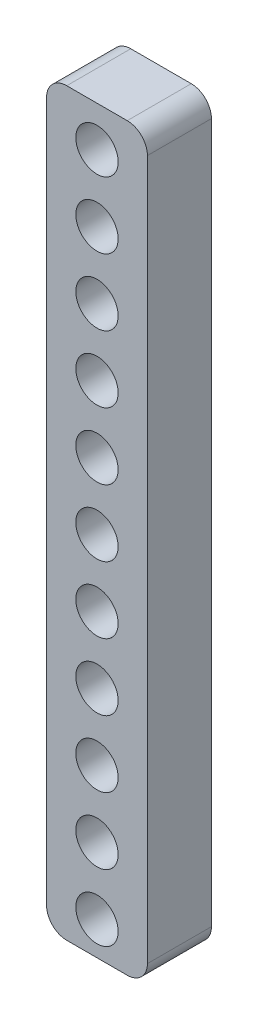
from build123d import *

# Parameters (mm, degrees)
SKETCH1_R           = 2.1
BOSS_EXTRUDE1_DEPTH = 6.35
SKETCH2_W           = 18.204542204
SKETCH2_H           = 91.842735445
CUT_EXTRUDE1_DEPTH  = 81.407229153
FILLET2_R           = 2


with BuildPart() as part:
    # Sketch1 → Boss-Extrude1 (new body)
    with BuildSketch(Plane.XY):
        with BuildLine():
            Line((3, -80), (-3, -80))
            ThreePointArc((-3, -80), (-4.414213562, -79.414213562), (-5, -78))
            Line((-5, -78), (-5, 78))
            ThreePointArc((-5, 78), (-4.414213562, 79.414213562), (-3, 80))
            Line((-3, 80), (3, 80))
            ThreePointArc((3, 80), (4.414213562, 79.414213562), (5, 78))
            Line((5, 78), (5, -78))
            ThreePointArc((5, -78), (4.414213562, -79.414213562), (3, -80))
        make_face()
        with Locations((0, 76)):
            Circle(SKETCH1_R, mode=Mode.SUBTRACT)
        with Locations((0, 69.391304348)):
            Circle(SKETCH1_R, mode=Mode.SUBTRACT)
        with Locations((0, 62.782608696)):
            Circle(SKETCH1_R, mode=Mode.SUBTRACT)
        with Locations((0, 56.173913043)):
            Circle(SKETCH1_R, mode=Mode.SUBTRACT)
        with Locations((0, 49.565217391)):
            Circle(SKETCH1_R, mode=Mode.SUBTRACT)
        with Locations((0, 42.956521739)):
            Circle(SKETCH1_R, mode=Mode.SUBTRACT)
        with Locations((0, 36.347826087)):
            Circle(SKETCH1_R, mode=Mode.SUBTRACT)
        with Locations((0, 29.739130435)):
            Circle(SKETCH1_R, mode=Mode.SUBTRACT)
        with Locations((0, 23.130434783)):
            Circle(SKETCH1_R, mode=Mode.SUBTRACT)
        with Locations((0, 16.52173913)):
            Circle(SKETCH1_R, mode=Mode.SUBTRACT)
        with Locations((0, 9.913043478)):
            Circle(SKETCH1_R, mode=Mode.SUBTRACT)
        with Locations((0, 3.304347826)):
            Circle(SKETCH1_R, mode=Mode.SUBTRACT)
        with Locations((0, -3.304347826)):
            Circle(SKETCH1_R, mode=Mode.SUBTRACT)
        with Locations((0, -9.913043478)):
            Circle(SKETCH1_R, mode=Mode.SUBTRACT)
        with Locations((0, -16.52173913)):
            Circle(SKETCH1_R, mode=Mode.SUBTRACT)
        with Locations((0, -23.130434783)):
            Circle(SKETCH1_R, mode=Mode.SUBTRACT)
        with Locations((0, -29.739130435)):
            Circle(SKETCH1_R, mode=Mode.SUBTRACT)
        with Locations((0, -36.347826087)):
            Circle(SKETCH1_R, mode=Mode.SUBTRACT)
        with Locations((0, -42.956521739)):
            Circle(SKETCH1_R, mode=Mode.SUBTRACT)
        with Locations((0, -49.565217391)):
            Circle(SKETCH1_R, mode=Mode.SUBTRACT)
        with Locations((0, -56.173913043)):
            Circle(SKETCH1_R, mode=Mode.SUBTRACT)
        with Locations((0, -62.782608696)):
            Circle(SKETCH1_R, mode=Mode.SUBTRACT)
        with Locations((0, -69.391304348)):
            Circle(SKETCH1_R, mode=Mode.SUBTRACT)
        with Locations((0, -76)):
            Circle(SKETCH1_R, mode=Mode.SUBTRACT)
    extrude(amount=BOSS_EXTRUDE1_DEPTH)

    # Sketch2 → Cut-Extrude1 (cut, through all)
    with BuildSketch(Plane(origin=(0, 0, 0), x_dir=(-1, 0, 0), z_dir=(0, 0, -1))):
        with Locations((-0.246007327, -39.312672071)):
            Rectangle(SKETCH2_W, SKETCH2_H)
    extrude(amount=-CUT_EXTRUDE1_DEPTH, mode=Mode.SUBTRACT)

    # Fillet2
    fillet2_edges = [part.edges().sort_by_distance(p)[0] for p in [
        (-5, 6.608695652, 3.175),
        (5, 6.608695652, 3.175),
    ]]
    fillet(fillet2_edges, radius=FILLET2_R)


solid = part.part
